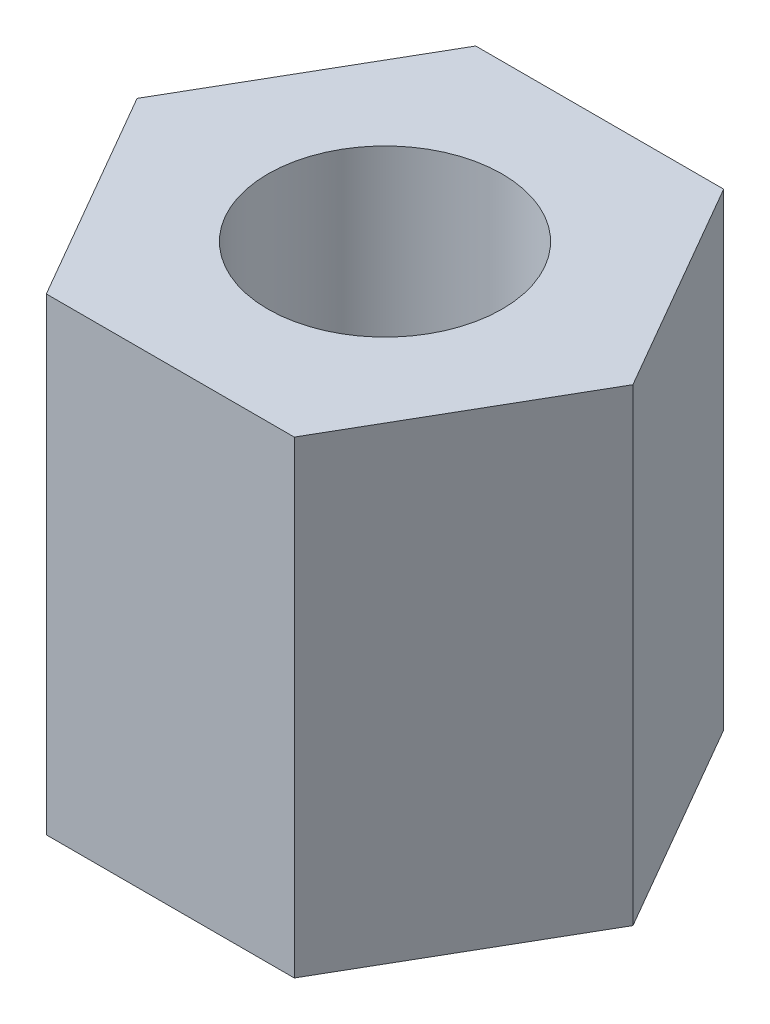
from build123d import *

# Parameters (mm, degrees)
SKETCH1_R           = 1.5
BOSS_EXTRUDE1_DEPTH = 6


with BuildPart() as part:
    # Sketch1 → Boss-Extrude1 (new body)
    with BuildSketch(Plane(origin=(0, 0, 0), x_dir=(1, 0, 0), z_dir=(0, 1, 0))):
        Polygon((1.58771324, 2.75), (-1.58771324, 2.75), (-3.175426481, 0), (-1.58771324, -2.75), (1.58771324, -2.75), (3.175426481, 0), align=None)
        with Locations(Location((0, 0, 0), (0, 0, 270))):
            Circle(SKETCH1_R, mode=Mode.SUBTRACT)
    extrude(amount=BOSS_EXTRUDE1_DEPTH)


solid = part.part
